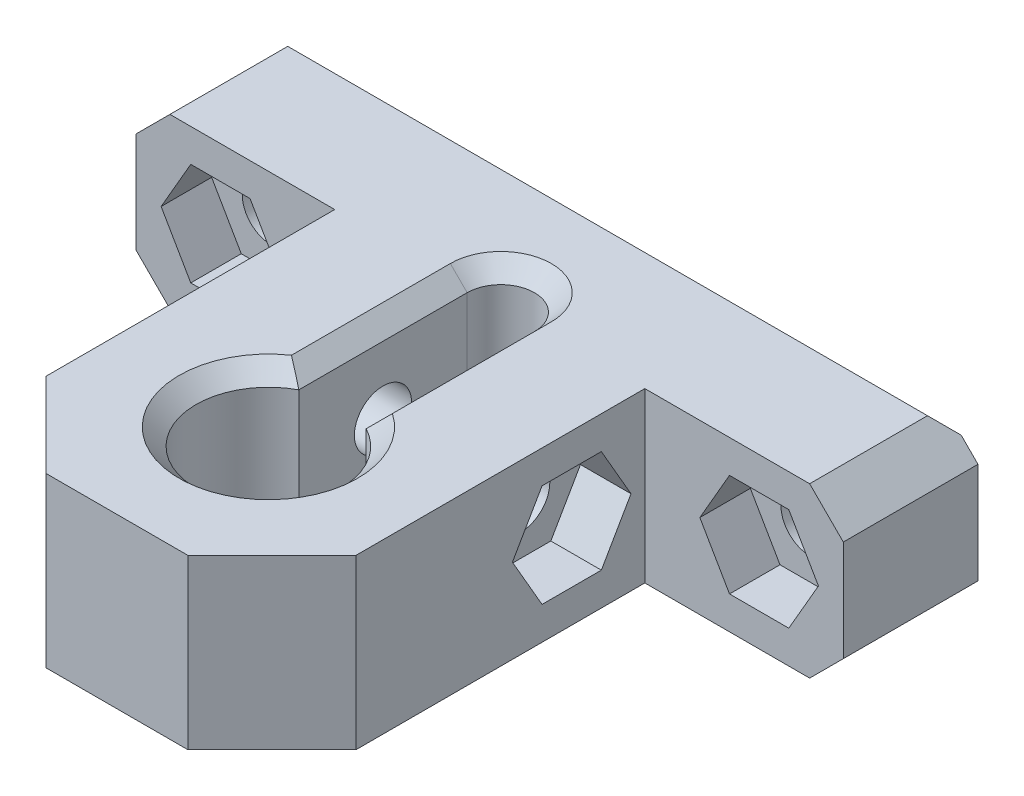
from build123d import *

# Parameters (mm, degrees)
BOSS_EXTRUDE1_DEPTH  = 10
CHAMFER1_SIZE        = 5
CHAMFER2_SIZE        = 2
CHAMFER3_SIZE        = 1
CUT_EXTRUDE1_DEPTH   = 3
M3_CLEARANCE_HOLE1_D = 3.4
CUT_EXTRUDE2_DEPTH   = 3


with BuildPart() as part:
    # Sketch1 → Boss-Extrude1 (new body)
    with BuildSketch(Plane(origin=(0, 0, 0), x_dir=(1, 0, 0), z_dir=(0, 1, 0))):
        Polygon((-21, 0), (21, 0), (21, -8), (9.21, -8), (9.21, -30.15), (-9.21, -30.15), (-9.21, -8), (-21, -8), align=None)
        with BuildLine():
            Line((-2, -7.343426738), (-2, -17.343426738))
            ThreePointArc((-2, -17.343426738), (0, -25.45), (2, -17.343426738))
            Line((2, -17.343426738), (2, -7.343426738))
            ThreePointArc((2, -7.343426738), (0, -5.343426738), (-2, -7.343426738))
        make_face(mode=Mode.SUBTRACT)
    extrude(amount=BOSS_EXTRUDE1_DEPTH)

    # Chamfer1
    chamfer1_edges = [part.edges().sort_by_distance(p)[0] for p in [
        (9.21, 5, 30.15),
        (-9.21, 5, 30.15),
    ]]
    chamfer(chamfer1_edges, length=CHAMFER1_SIZE)

    # Chamfer2
    chamfer2_edges = [part.edges().sort_by_distance(p)[0] for p in [
        (-21, 0, 4),
        (21, 10, 4),
        (-21, 10, 4),
        (21, 0, 4),
    ]]
    chamfer(chamfer2_edges, length=CHAMFER2_SIZE)

    # Chamfer3
    chamfer3_edges = [part.edges().sort_by_distance(p)[0] for p in [
        (0, 0, 5.343426738),
        (-2, 0, 12.343426738),
        (0, 0, 25.45),
        (2, 0, 12.343426738),
        (0, 10, 5.343426738),
        (-2, 10, 12.343426738),
        (0, 10, 25.45),
        (2, 10, 12.343426738),
        (0, 0, 0),
        (0, 10, 0),
    ]]
    chamfer(chamfer3_edges, length=CHAMFER3_SIZE)

    # Sketch2 → Cut-Extrude1 (cut)
    with BuildSketch(Plane(origin=(9.21, 0, 0), x_dir=(0, 0, -1), z_dir=(1, 0, 0))):
        Polygon((-10.582508417, 1.95), (-8.821590096, 5), (-10.582508417, 8.05), (-14.104345059, 8.05), (-15.86526338, 5), (-14.104345059, 1.95), align=None)
    extrude(amount=-CUT_EXTRUDE1_DEPTH, mode=Mode.SUBTRACT)

    # Sketch6 → CBORE for M3 Hex Socket Head Cap Screw1 (revolve, cut)
    with BuildSketch(Plane(origin=(-9.21, 5, 12.343426738), x_dir=(0, 0, 1), z_dir=(0, 1, 0))):
        Polygon((0, 0), (0, 30.21), (1.7, 30.21), (1.7, 3.4), (3.25, 3.4), (3.25, 0.025), (3.275, 0), align=None)
    revolve(axis=Axis((-15.56, 5, 12.343426738), (1, 0, 0)), mode=Mode.SUBTRACT)

    # M3 Clearance Hole1 (through all)
    with Locations(Plane(origin=(0, 0, 0), x_dir=(-1, 0, 0), z_dir=(0, 0, -1))):
        with Locations((16, 5), (-16, 5)):
            Hole(M3_CLEARANCE_HOLE1_D / 2)

    # Sketch9 → Cut-Extrude2 (cut)
    with BuildSketch(Plane(origin=(0, 0, 8), x_dir=(-1, 0, 0), z_dir=(0, 0, -1))):
        Polygon((17.760918321, 1.95), (19.521836642, 5), (17.760918321, 8.05), (14.239081679, 8.05), (12.478163358, 5), (14.239081679, 1.95), align=None)
        Polygon((-14.239081679, 1.95), (-17.760918321, 1.95), (-19.521836642, 5), (-17.760918321, 8.05), (-14.239081679, 8.05), (-12.478163358, 5), align=None)
    extrude(amount=CUT_EXTRUDE2_DEPTH, mode=Mode.SUBTRACT)


solid = part.part
